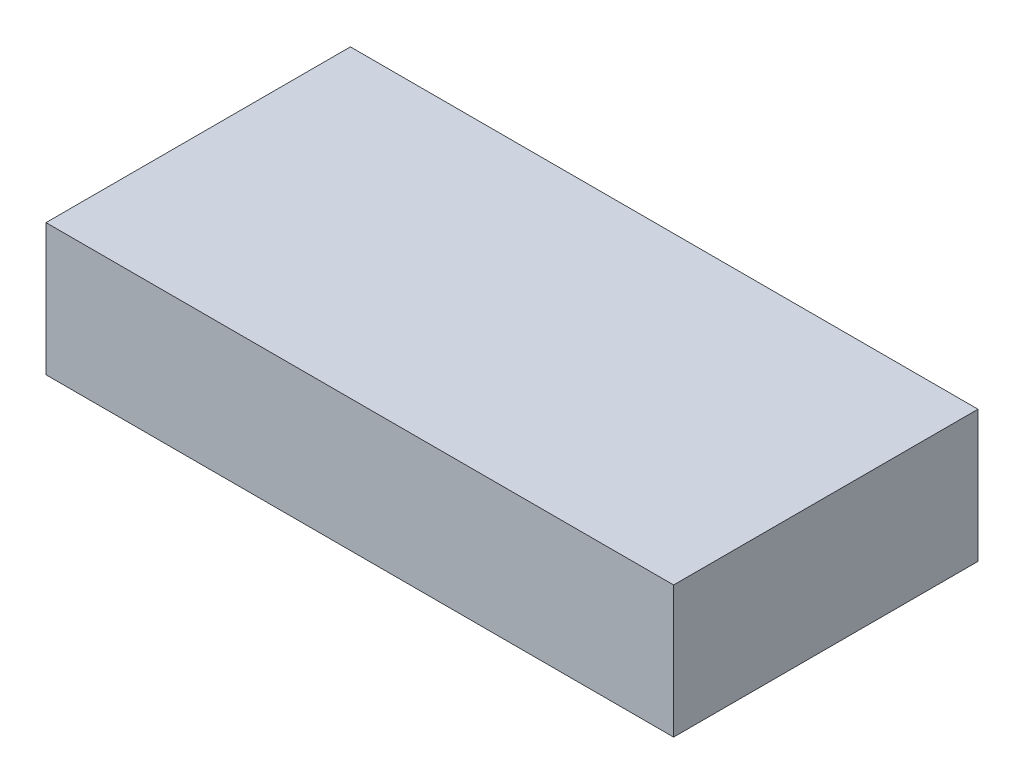
from build123d import *

# Parameters (mm, degrees)
SKETCH1_W           = 200
SKETCH1_H           = 97
BOSS_EXTRUDE1_DEPTH = 42


with BuildPart() as part:
    # Sketch1 → Boss-Extrude1 (new body)
    with BuildSketch(Plane(origin=(0, 0, 0), x_dir=(1, 0, 0), z_dir=(0, 1, 0))):
        Rectangle(SKETCH1_W, SKETCH1_H)
    extrude(amount=BOSS_EXTRUDE1_DEPTH)


solid = part.part
